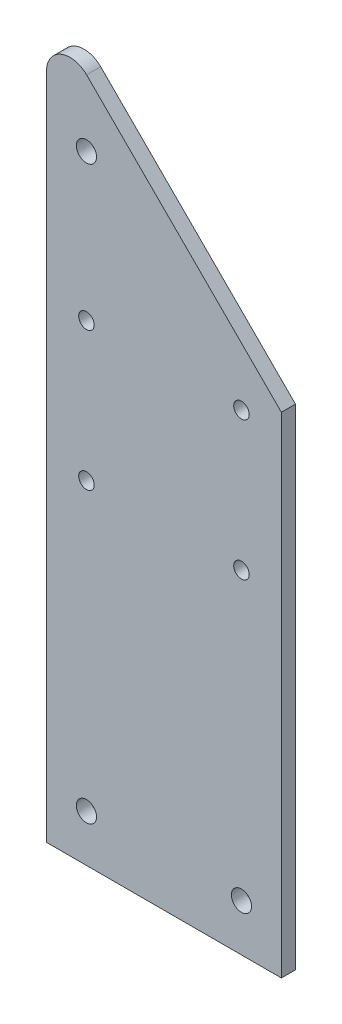
from build123d import *

# Parameters (mm, degrees)
EXTRUDE_1_DEPTH     = 3
SKETCH_2_R          = 2.15
SKETCH_2_R_2        = 1.65
CUT_EXTRUDE_1_DEPTH = 3
FILLET_1_R          = 5


with BuildPart() as part:
    # 草图1 → 凸台-拉伸1 (new body)
    with BuildSketch(Plane.XY):
        Polygon((0, 0), (0, 154.3), (50, 104.3), (50, 0), align=None)
    extrude(amount=EXTRUDE_1_DEPTH)

    # 草图2 → 切除-拉伸1 (cut)
    with BuildSketch(Plane.XY.offset(3)):
        with Locations((8.5, 10)):
            Circle(SKETCH_2_R)
        with Locations((41.5, 10)):
            Circle(SKETCH_2_R)
        with Locations((8.5, 131.657864376)):
            Circle(SKETCH_2_R)
        with Locations((8.5, 100.45)):
            Circle(SKETCH_2_R_2)
        with Locations((8.5, 70.95)):
            Circle(SKETCH_2_R_2)
        with Locations((41.5, 70.95)):
            Circle(SKETCH_2_R_2)
        with Locations((41.5, 100.45)):
            Circle(SKETCH_2_R_2)
    extrude(amount=-CUT_EXTRUDE_1_DEPTH, mode=Mode.SUBTRACT)

    # 圆角1
    fillet_1_edges = [part.edges().sort_by_distance(p)[0] for p in [
        (0, 154.3, 1.5),
    ]]
    fillet(fillet_1_edges, radius=FILLET_1_R)


solid = part.part
